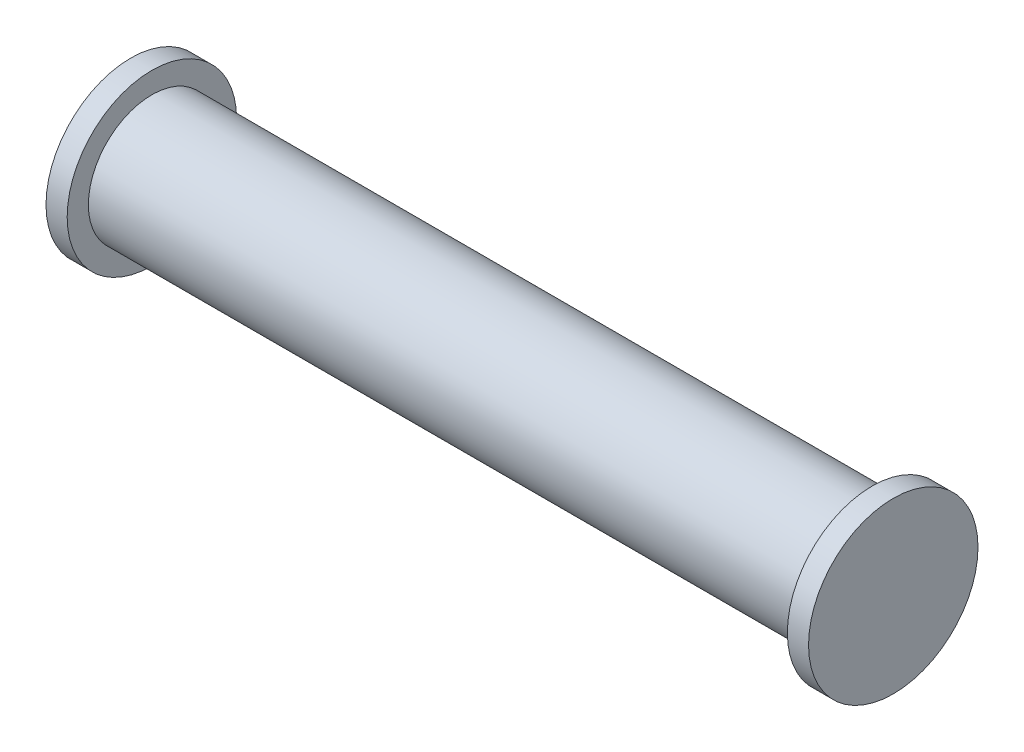
from build123d import *

# Parameters (mm, degrees)
SKETCH1_R           = 3.81
BOSS_EXTRUDE1_DEPTH = 43.18
SKETCH2_R           = 5.08
BOSS_EXTRUDE2_DEPTH = 1.27
BOSS_EXTRUDE3_START = 1.27
SKETCH3_R           = 5.08
BOSS_EXTRUDE3_DEPTH = 1.27


with BuildPart() as part:
    # Sketch1 → Boss-Extrude1 (new body)
    with BuildSketch(Plane(origin=(0, 0, 0), x_dir=(0, 0, -1), z_dir=(1, 0, 0))):
        Circle(SKETCH1_R)
    extrude(amount=BOSS_EXTRUDE1_DEPTH)

    # Sketch2 → Boss-Extrude2 (add)
    with BuildSketch(Plane(origin=(43.18, 0, 0), x_dir=(0, 0, -1), z_dir=(1, 0, 0))):
        Circle(SKETCH2_R)
    extrude(amount=BOSS_EXTRUDE2_DEPTH)

    # Sketch3 → Boss-Extrude3 (add)
    with BuildSketch(Plane.ZY.offset(BOSS_EXTRUDE3_START)):
        with Locations(Location((0, 0, 0), (0, 0, 180))):
            Circle(SKETCH3_R)
    extrude(amount=-BOSS_EXTRUDE3_DEPTH)


solid = part.part
